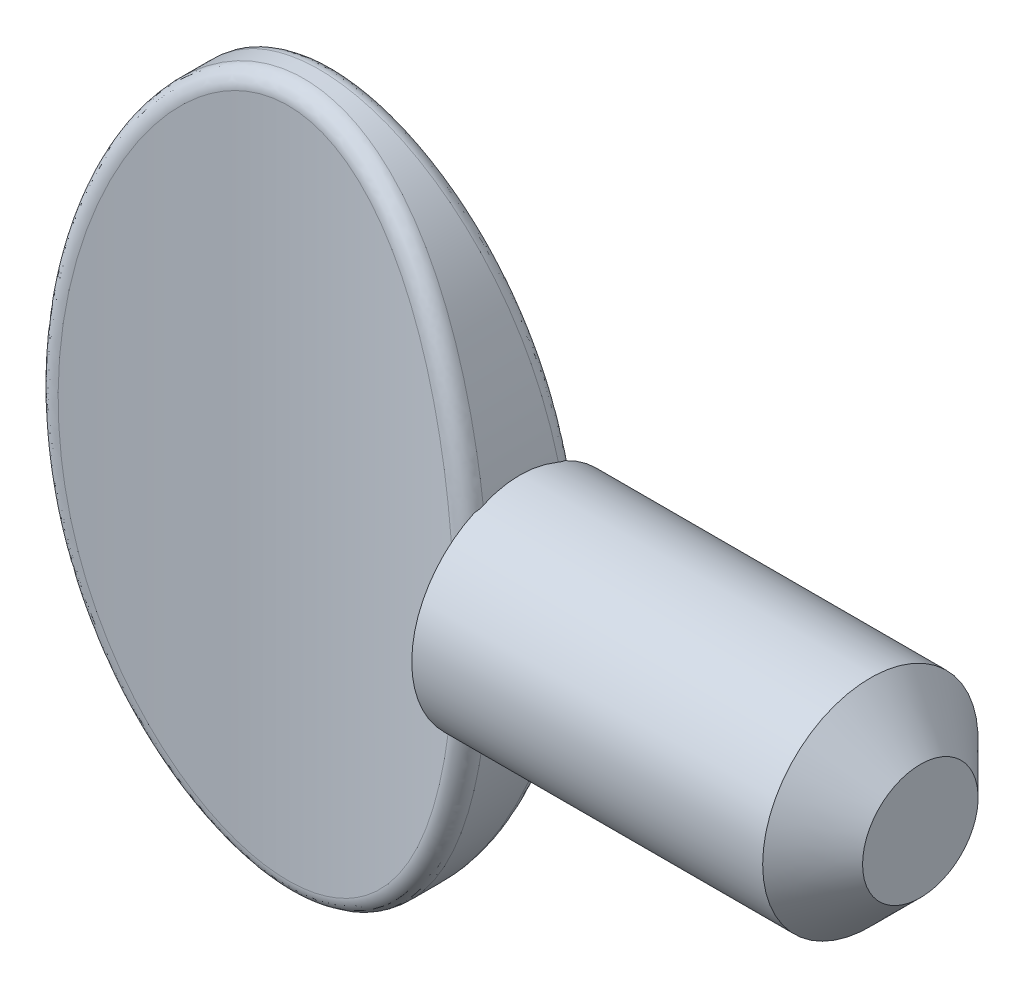
from build123d import *

# Parameters (mm, degrees)
SKETCH1_RX              = 5.715
SKETCH1_RY              = 3.556
EXTRUDE1_DEPTH          = 1.016
CUT_EXTRUDE1_DEPTH      = 7.8072473878947575
CUT_EXTRUDE1_DEPTH_BACK = 7.8072473878947575
SKETCH2_OUTSIDE_W       = 11.834000000000001
SKETCH2_OUTSIDE_H       = 6.754
FILLET3_R               = 0.254


with BuildPart() as part:
    # Sketch1 → Extrude1 (new, symmetric)
    with BuildSketch(Plane.XY):
        with Locations(Location((0, 0), (0, 0, -90))):
            Ellipse(SKETCH1_RX, SKETCH1_RY)
    extrude(amount=EXTRUDE1_DEPTH, both=True)

    # Sketch2 outside → Cut-Extrude1 (cut, two sides: drawn at the far end of the back side and taken through both)
    with BuildSketch(Plane(origin=(0, 0, 0), x_dir=(1, 0, 0), z_dir=(0, 1, 0)).offset(-CUT_EXTRUDE1_DEPTH_BACK)):
        Rectangle(SKETCH2_OUTSIDE_W, SKETCH2_OUTSIDE_H)
        with BuildLine():
            Line((-3.556, 1.016), (-3.556, -1.016))
            ThreePointArc((-3.556, -1.016), (6.3e-16, -0.3810000000000002), (3.556, -1.016))
            Line((3.556, -1.016), (3.556, 1.016))
            ThreePointArc((3.556, 1.016), (6.3e-16, 0.3810000000000002), (-3.556, 1.016))
        make_face(mode=Mode.SUBTRACT)
    extrude(amount=CUT_EXTRUDE1_DEPTH + CUT_EXTRUDE1_DEPTH_BACK, mode=Mode.SUBTRACT)

    # Fillet3
    fillet3_edges = [part.edges().sort_by_distance(p)[0] for p in [
        (-2.772297743363364, -3.579097133488567, 0.7620899166368158),
        (6.761380256e-08, 5.714999999994567, -0.38099999999467776),
    ]]
    fillet(fillet3_edges, radius=FILLET3_R)

    # Sketch3 → Revolve1 (revolve)
    with BuildSketch(Plane(origin=(0, 0, 0), x_dir=(1, 0, 0), z_dir=(0, 1, 0))):
        with BuildLine():
            Line((9.906, 0), (9.906, 0.9398))
            Line((9.906, 0.9398), (9.09319999999999, 1.7526))
            Line((9.09319999999999, 1.7526), (4.741333333333333, 1.7526))
            Line((4.741333333333333, 1.7526), (3.3846611661960426, 1.7526000000000004))
            ThreePointArc((3.3846611661960426, 1.7526000000000004), (3.1592934071520324, 1.093146291526699), (2.577464628985661, 0.7095513315322604))
            Line((2.577464628985661, 0.7095513315322604), (2.577464628985661, 1e-17))
            Line((2.577464628985661, 1e-17), (9.906, 0))
        make_face()
    revolve(axis=Axis((0, 0, 0), (1, 0, 0)))


solid = part.part
